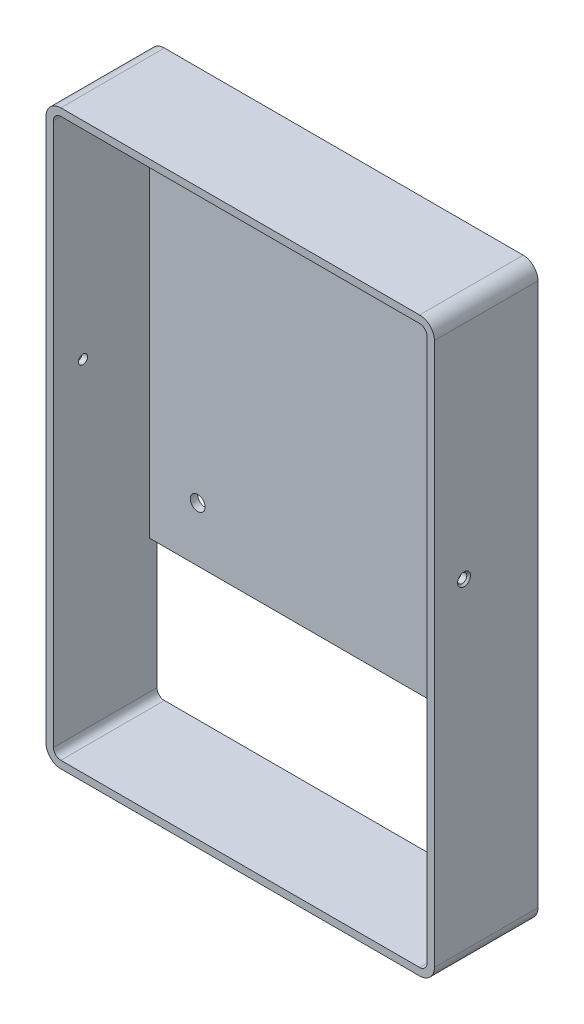
from build123d import *

# Parameters (mm, degrees)
BOSS_EXTRUDE1_DEPTH         = 28
SHELL1_T                    = -2
CUT_EXTRUDE1_START          = -10
SKETCH2_R                   = 2
CUT_EXTRUDE1_DEPTH          = 10
M3_TAPPED_HOLE1_D           = 2.5
M3_TAPPED_HOLE1_DEPTH       = 2
M3_TAPPED_HOLE1_CSINK_D     = 3.5
M3_TAPPED_HOLE1_CSINK_ANGLE = 90
M3_TAPPED_HOLE2_D           = 2.5
M3_TAPPED_HOLE2_CSINK_D     = 3.5
M3_TAPPED_HOLE2_CSINK_ANGLE = 90


with BuildPart() as part:
    # Sketch1 → Boss-Extrude1 (new body)
    with BuildSketch(Plane.XY):
        with BuildLine():
            Line((-48.5, 63.875), (48.5, 63.875))
            ThreePointArc((48.5, 63.875), (51.328427125, 62.703427125), (52.5, 59.875))
            Line((52.5, 59.875), (52.5, -86.875))
            ThreePointArc((52.5, -86.875), (51.328427125, -89.703427125), (48.5, -90.875))
            Line((48.5, -90.875), (-48.5, -90.875))
            ThreePointArc((-48.5, -90.875), (-51.328427125, -89.703427125), (-52.5, -86.875))
            Line((-52.5, -86.875), (-52.5, 59.875))
            ThreePointArc((-52.5, 59.875), (-51.328427125, 62.703427125), (-48.5, 63.875))
        make_face()
    extrude(amount=-BOSS_EXTRUDE1_DEPTH)

    # Shell1
    shell1_openings = [part.faces().sort_by_distance(p)[0] for p in [
        (0, -13.5, 0),
    ]]
    offset(amount=SHELL1_T, openings=shell1_openings, kind=Kind.INTERSECTION)

    # Sketch2 → Cut-Extrude1 (cut)
    with BuildSketch(Plane(origin=(0, 0, -28), x_dir=(-1, 0, 0), z_dir=(0, 0, -1)).offset(CUT_EXTRUDE1_START)):
        with Locations((-37.5, 48.875)):
            Circle(SKETCH2_R)
        with Locations((37.5, 48.875)):
            Circle(SKETCH2_R)
        with Locations((37.5, -36.125)):
            Circle(SKETCH2_R)
        with Locations((-37.5, -36.125)):
            Circle(SKETCH2_R)
        with BuildLine():
            Line((-50.5, -50.875), (50.5, -50.875))
            Line((50.5, -50.875), (50.5, -86.875))
            ThreePointArc((50.5, -86.875), (49.914213562, -88.289213562), (48.5, -88.875))
            Line((48.5, -88.875), (-48.5, -88.875))
            ThreePointArc((-48.5, -88.875), (-49.914213562, -88.289213562), (-50.5, -86.875))
            Line((-50.5, -86.875), (-50.5, -50.875))
        make_face()
    extrude(amount=CUT_EXTRUDE1_DEPTH, mode=Mode.SUBTRACT)

    # M3 Tapped Hole1
    with Locations(Plane(origin=(52.5, 0, 0), x_dir=(0, 0, -1), z_dir=(1, 0, 0))):
        with Locations((8, 0)):
            CounterSinkHole(M3_TAPPED_HOLE1_D / 2, M3_TAPPED_HOLE1_CSINK_D / 2, depth=M3_TAPPED_HOLE1_DEPTH, counter_sink_angle=M3_TAPPED_HOLE1_CSINK_ANGLE)

    # M3 Tapped Hole2 (through all)
    with Locations(Plane.ZY.offset(52.5)):
        with Locations((-8, 0)):
            CounterSinkHole(M3_TAPPED_HOLE2_D / 2, M3_TAPPED_HOLE2_CSINK_D / 2, counter_sink_angle=M3_TAPPED_HOLE2_CSINK_ANGLE)


solid = part.part
